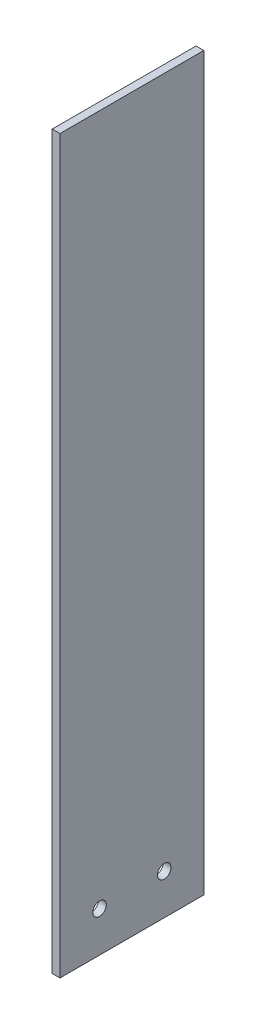
from build123d import *

# Parameters (mm, degrees)
SKETCH1_W                  = 56.4388
SKETCH1_H                  = 287.02
BOSS_EXTRUDE1_DEPTH        = 3.048
F_4_0_209_DIAMETER_HOLE1_D = 5.3086


with BuildPart() as part:
    # Sketch1 → Boss-Extrude1 (new body)
    with BuildSketch(Plane(origin=(0, 0, 0), x_dir=(0, 0, -1), z_dir=(1, 0, 0))):
        Rectangle(SKETCH1_W, SKETCH1_H)
    extrude(amount=BOSS_EXTRUDE1_DEPTH)

    # #4 (0.209) Diameter Hole1 (through all)
    with Locations(Plane(origin=(3.048, 0, 0), x_dir=(0, 0, -1), z_dir=(1, 0, 0))):
        with Locations((-12.7, -127.7112), (12.7, -127.7112)):
            Hole(F_4_0_209_DIAMETER_HOLE1_D / 2)


solid = part.part
